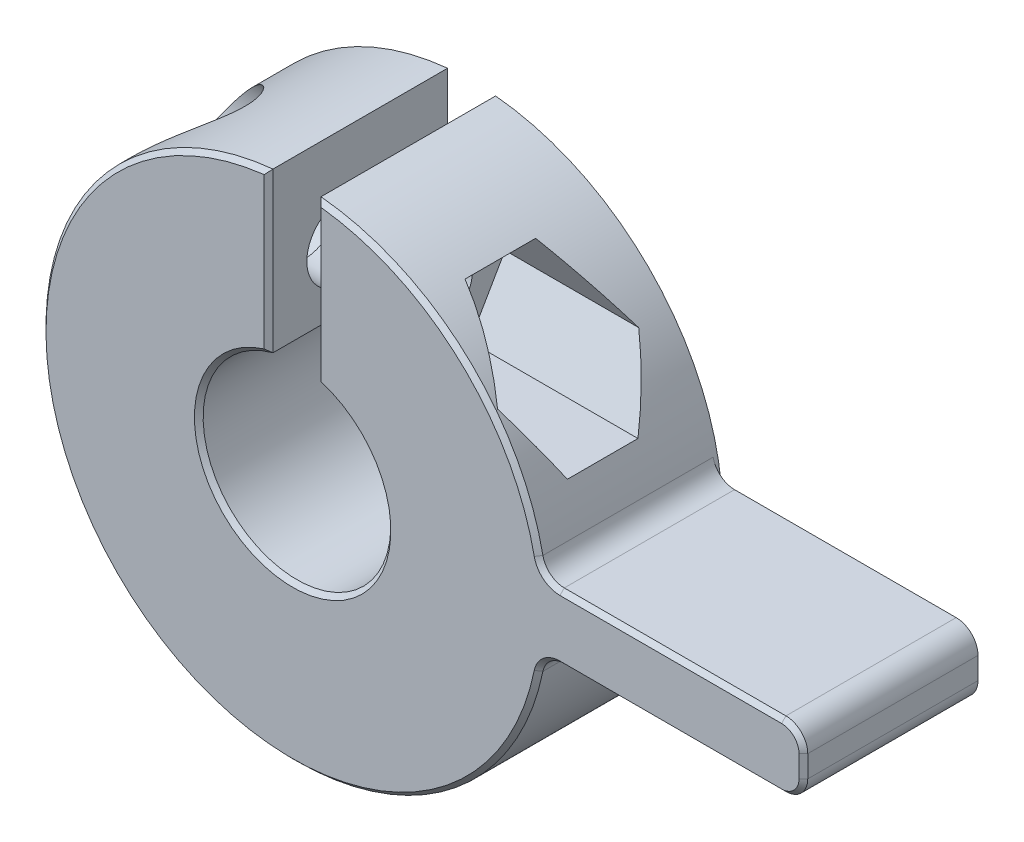
from build123d import *

# Parameters (mm, degrees)
BOSS_EXTRUDE1_DEPTH     = 15
CUT_EXTRUDE4_START      = -3
SKETCH4_R               = 3
SKETCH4_R_2             = 1.75
CUT_EXTRUDE4_DEPTH      = 15
CUT_EXTRUDE5_DEPTH      = 23.124647062
CUT_EXTRUDE5_DEPTH_BACK = 23.124647062
SKETCH4_2_R             = 1.75
CUT_EXTRUDE6_START      = 3
CUT_EXTRUDE6_DEPTH      = 15
SKETCH6_R               = 14
CUT_EXTRUDE7_DEPTH      = 6.8
SKETCH7_W               = 12
SKETCH7_H               = 3
BOSS_EXTRUDE2_DEPTH     = 8
FILLET1_R               = 1
CHAMFER2_SIZE           = 0.2


with BuildPart() as part:
    # Sketch1 → Boss-Extrude1 (new body)
    with BuildSketch(Plane.XY):
        with BuildLine():
            Line((1.1, 11.447270417), (1.1, 4.156921938))
            ThreePointArc((1.1, 4.156921938), (3.407345007, 2.62297541), (4.3, 0))
            ThreePointArc((4.3, 0), (-2.62297541, -3.407345007), (-1.1, 4.156921938))
            Line((-1.1, 4.156921938), (-1.1, 11.447270417))
            ThreePointArc((-1.1, 11.447270417), (-7.733045972, -8.511756575), (11.5, 0))
            ThreePointArc((11.5, 0), (8.511756575, 7.733045972), (1.1, 11.447270417))
        make_face()
    extrude(amount=BOSS_EXTRUDE1_DEPTH)

    # Sketch4 → Cut-Extrude4 (cut)
    # profile 1 of 2: a face of its own
    with BuildSketch(Plane(origin=(0, 0, 0), x_dir=(0, 0, -1), z_dir=(1, 0, 0)).offset(CUT_EXTRUDE4_START)):
        with Locations((-11.5, 7)):
            Circle(SKETCH4_R)
        with Locations((-11.5, 7)):
            Circle(SKETCH4_R_2, mode=Mode.SUBTRACT)
    # profile 2 of 2: a face of its own
    with BuildSketch(Plane(origin=(0, 0, 0), x_dir=(0, 0, -1), z_dir=(1, 0, 0)).offset(CUT_EXTRUDE4_START)):
        with Locations((-3.5, 7)):
            Circle(SKETCH4_R)
        with Locations((-3.5, 7)):
            Circle(SKETCH4_R_2, mode=Mode.SUBTRACT)
    extrude(amount=-CUT_EXTRUDE4_DEPTH, mode=Mode.SUBTRACT)

    # Sketch4<2> → Cut-Extrude5 (cut, two sides: drawn at the far end of the back side and taken through both)
    with BuildSketch(Plane(origin=(0, 0, 0), x_dir=(0, 0, -1), z_dir=(1, 0, 0)).offset(-CUT_EXTRUDE5_DEPTH_BACK)):
        with Locations((-3.5, 7)):
            Circle(SKETCH4_2_R)
        with Locations((-11.5, 7)):
            Circle(SKETCH4_2_R)
    extrude(amount=CUT_EXTRUDE5_DEPTH + CUT_EXTRUDE5_DEPTH_BACK, mode=Mode.SUBTRACT)

    # Sketch5 → Cut-Extrude6 (cut)
    with BuildSketch(Plane(origin=(0, 0, 0), x_dir=(0, 0, -1), z_dir=(1, 0, 0)).offset(CUT_EXTRUDE6_START)):
        Polygon((-9.883419246, 9.8), (-13.116580754, 9.8), (-14.733161507, 7), (-13.116580754, 4.2), (-9.883419246, 4.2), (-8.266838493, 7), align=None)
        Polygon((-1.883419246, 9.8), (-5.116580754, 9.8), (-6.733161507, 7), (-5.116580754, 4.2), (-1.883419246, 4.2), (-0.266838493, 7), align=None)
    extrude(amount=CUT_EXTRUDE6_DEPTH, mode=Mode.SUBTRACT)

    # Sketch6 → Cut-Extrude7 (cut)
    with BuildSketch(Plane(origin=(0, 0, 0), x_dir=(-1, 0, 0), z_dir=(0, 0, -1))):
        Circle(SKETCH6_R)
    extrude(amount=-CUT_EXTRUDE7_DEPTH, mode=Mode.SUBTRACT)

    # Sketch7 → Boss-Extrude2 (add)
    with BuildSketch(Plane.XY.offset(15)):
        with Locations((17.401754251, 0)):
            Rectangle(SKETCH7_W, SKETCH7_H)
    extrude(amount=-BOSS_EXTRUDE2_DEPTH)

    # Fillet1
    fillet1_edges = [part.edges().sort_by_distance(p)[0] for p in [
        (23.401754251, 1.5, 11),
        (23.401754251, -1.5, 11),
        (11.401754251, -1.5, 11),
        (11.401754251, 1.5, 11),
    ]]
    fillet(fillet1_edges, radius=FILLET1_R)

    # Chamfer2
    chamfer2_edges = [part.edges().sort_by_distance(p)[0] for p in [
        (0, -4.3, 15),
        (1.1, 7.802096178, 15),
        (7.691413919, 8.549394828, 15),
        (-8.549394828, -7.691413919, 15),
        (-1.1, 7.802096178, 15),
        (23.108861032, -1.207106781, 15),
        (17.324601482, -1.5, 15),
        (11.614993182, -1.725403331, 15),
        (11.614993182, 1.725403331, 15),
        (17.324601482, 1.5, 15),
        (23.108861032, 1.207106781, 15),
        (23.401754251, 0, 15),
    ]]
    chamfer(chamfer2_edges, length=CHAMFER2_SIZE)


solid = part.part
